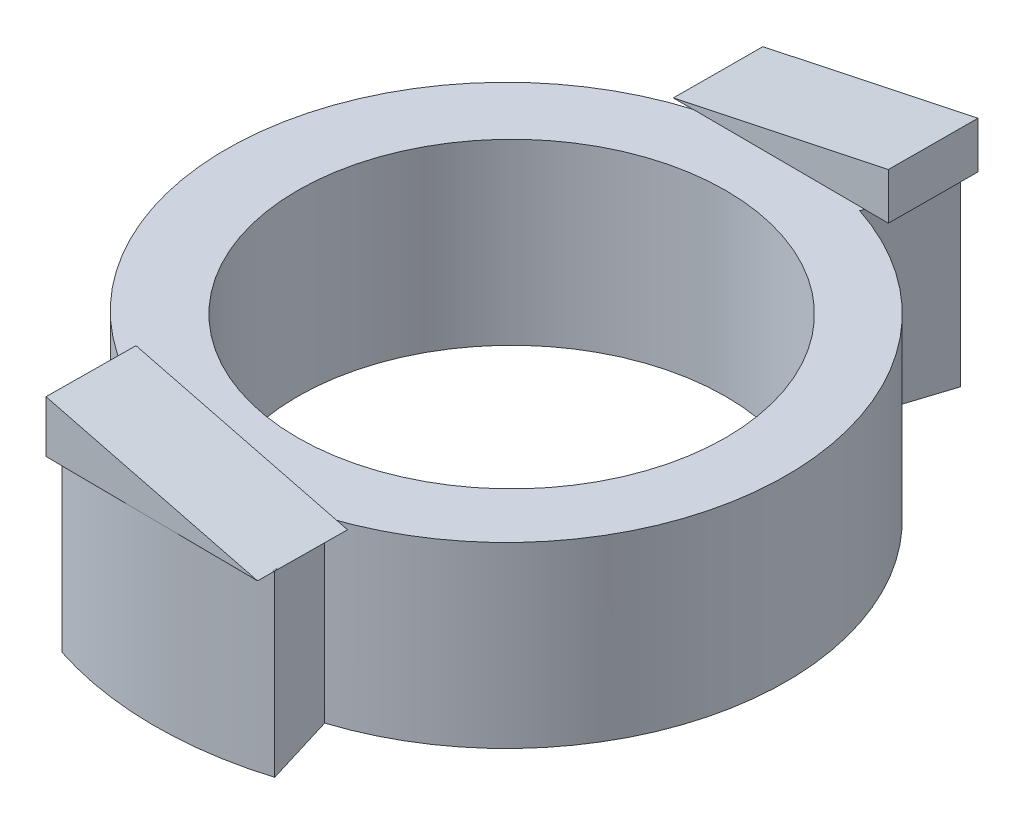
from build123d import *

# Parameters (mm, degrees)
SKETCH1_R           = 12
BOSS_EXTRUDE1_DEPTH = 10
BOSS_EXTRUDE2_DEPTH = 5
BOSS_EXTRUDE3_DEPTH = 5


with BuildPart() as part:
    # Sketch1 → Boss-Extrude1 (new body)
    with BuildSketch(Plane(origin=(0, 0, 0), x_dir=(1, 0, 0), z_dir=(0, 1, 0))):
        with BuildLine():
            Line((-5.938922448, 19.097884704), (-4.65723572, 15.077087101))
            ThreePointArc((-4.65723572, 15.077087101), (-16.000205846, 0.123004291), (-4.888486885, -15.003702742))
            Line((-4.888486885, -15.003702742), (-6.195800868, -19.0160998))
            ThreePointArc((-6.195800868, -19.0160998), (-0.182924717, -19.999163446), (5.846927348, -19.12625004))
            Line((5.846927348, -19.12625004), (4.613225677, -15.090611282))
            ThreePointArc((4.613225677, -15.090611282), (15.53596231, -0.206998546), (4.736250871, 14.766121919))
            Line((4.736250871, 14.766121919), (6.108489826, 19.04432598))
            ThreePointArc((6.108489826, 19.04432598), (0.088912362, 19.999802364), (-5.938922448, 19.097884704))
        make_face()
        with Locations(Location((0, 0, 0), (0, 0, 270))):
            Circle(SKETCH1_R, mode=Mode.SUBTRACT)
    extrude(amount=BOSS_EXTRUDE1_DEPTH)

    # Sketch2 → Boss-Extrude2 (add)
    with BuildSketch(Plane(origin=(-0.182924717, 10, 19.999163446), x_dir=(0.9999581723101434, 0, 0.009146235846386387), z_dir=(-0.009146235846386385, 0, 0.9999581723101433))):
        Polygon((-5.97117687, -0.015009165), (5.99330158, -0.015009165), (-5.97117687, 2.885349138), align=None)
    extrude(amount=-BOSS_EXTRUDE2_DEPTH)

    # Sketch3 → Boss-Extrude3 (add)
    with BuildSketch(Plane(origin=(0.088912362, 10, -19.999802364), x_dir=(-0.9999901181910447, 0, -0.004445618096607563), z_dir=(0.004445618096607563, 0, -0.9999901181910447))):
        Polygon((-6.073960735, -0.007479705), (6.036027913, -0.007479705), (-6.073960735, 2.600191919), align=None)
    extrude(amount=-BOSS_EXTRUDE3_DEPTH)


solid = part.part
